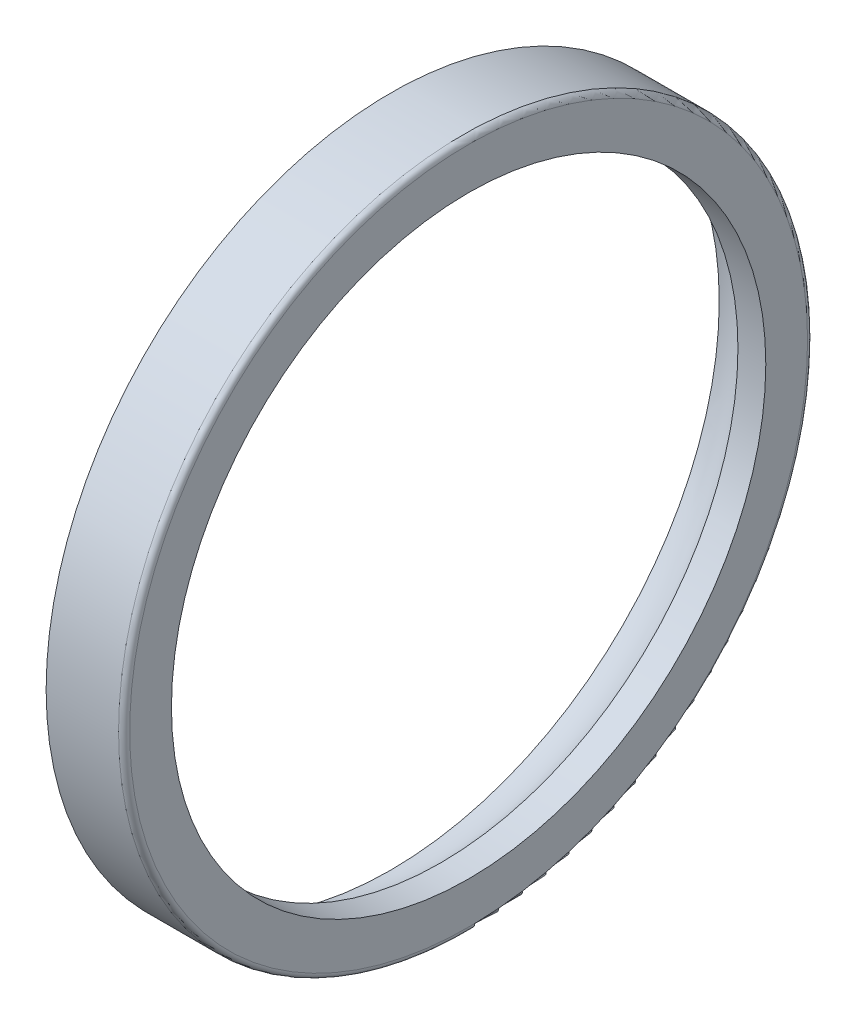
from build123d import *


with BuildPart() as part:
    # Esquisse1 → Base-Révolution (revolve)
    with BuildSketch(Plane.XY, mode=Mode.PRIVATE) as base_r_volution_sk:
        with BuildLine():
            Line((11.791631281, 30.929194786), (18.291631281, 30.929194786))
            ThreePointArc((18.291631281, 30.929194786), (18.645184672, 30.782748177), (18.791631281, 30.429194786))
            Line((18.791631281, 30.429194786), (18.791631281, 26.679194786))
            Line((18.791631281, 26.679194786), (16.291754622, 26.679194786))
            ThreePointArc((16.291754622, 26.679194786), (14.44719394, 28.736506458), (11.791631281, 29.5))
            Line((11.791631281, 29.5), (11.791631281, 30.929194786))
        make_face()
    revolve(base_r_volution_sk.sketch.rotate(Axis((21.339230801, 0, 0), (-1, 0, 0)), 90), axis=Axis((21.339230801, 0, 0), (-1, 0, 0)))


solid = part.part
